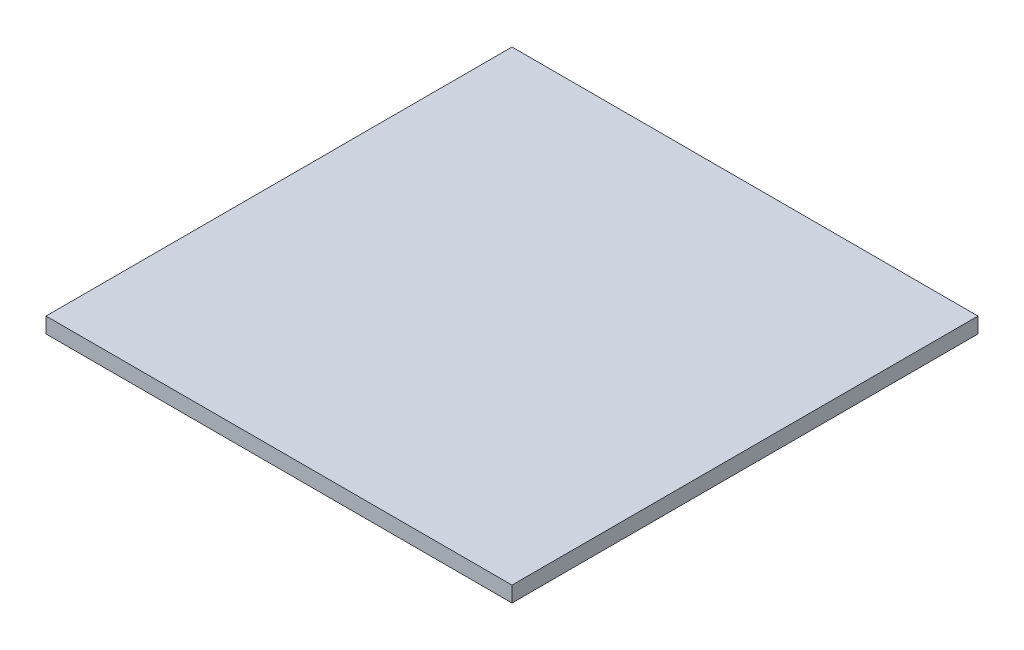
from build123d import *

# Parameters (mm, degrees)
SKETCH1_W           = 150
SKETCH1_H           = 130
BOSS_EXTRUDE1_DEPTH = 5
SKETCH2_W           = 150
SKETCH2_H           = 5
BOSS_EXTRUDE2_DEPTH = 20


with BuildPart() as part:
    # Sketch1 → Boss-Extrude1 (new body)
    with BuildSketch(Plane(origin=(0, 0, 0), x_dir=(1, 0, 0), z_dir=(0, 1, 0))):
        Rectangle(SKETCH1_W, SKETCH1_H)
    extrude(amount=BOSS_EXTRUDE1_DEPTH)

    # Sketch2 → Boss-Extrude2 (add)
    with BuildSketch(Plane.XY.offset(65)):
        with Locations((0, 2.5)):
            Rectangle(SKETCH2_W, SKETCH2_H)
    extrude(amount=BOSS_EXTRUDE2_DEPTH)


solid = part.part
